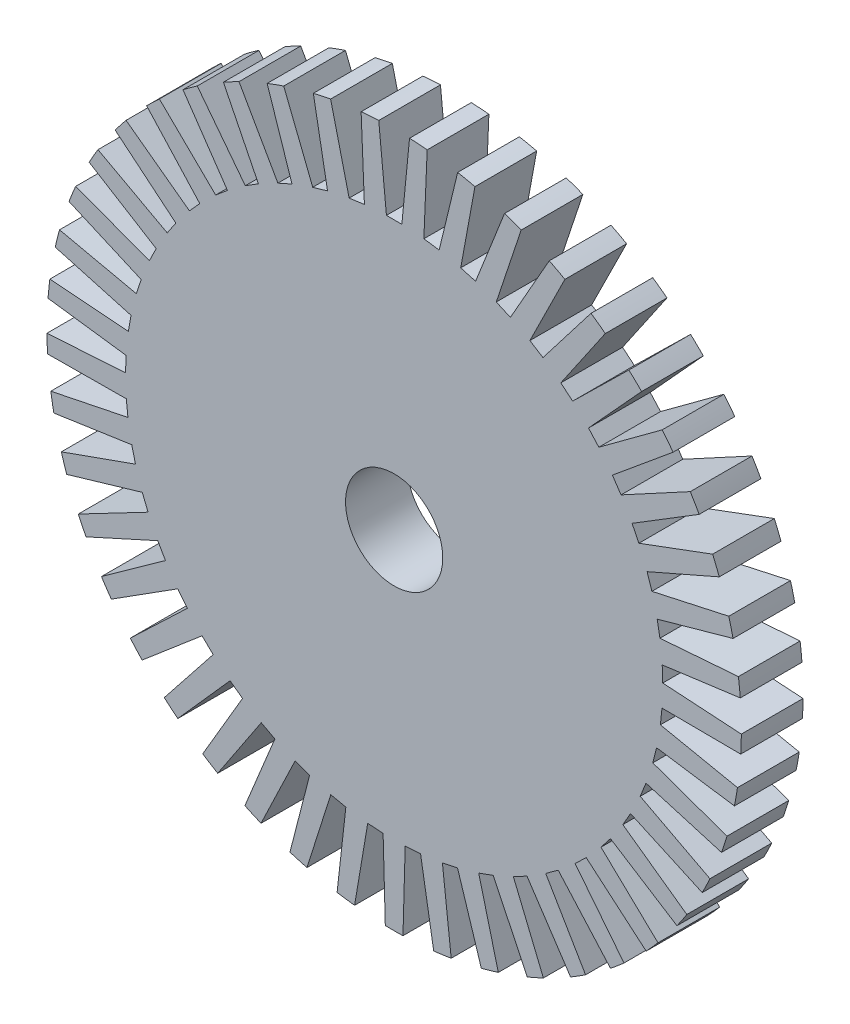
from build123d import *

# Parameters (mm, degrees)
SKETCH1_R           = 3.15
BOSS_EXTRUDE1_DEPTH = 4


with BuildPart() as part:
    # Sketch1 → Boss-Extrude1 (new body)
    with BuildSketch(Plane.XY):
        with BuildLine():
            Line((-0.5, 17.400093673), (-0.99782969, 22.477863242))
            ThreePointArc((-0.99782969, 22.477863242), (-1.569520659, 22.445191131), (-2.140195051, 22.397981274))
            Line((-2.140195051, 22.397981274), (-1.926490959, 17.300343708))
            Line((-1.926490959, 17.300343708), (-2.916759028, 17.161170607))
            Line((-2.916759028, 17.161170607), (-4.11643281, 22.12023917))
            ThreePointArc((-4.11643281, 22.12023917), (-4.678013043, 22.008321017), (-5.236563329, 21.882148078))
            Line((-5.236563329, 21.882148078), (-4.315484963, 16.863862232))
            Line((-4.315484963, 16.863862232), (-5.276746659, 16.588224876))
            Line((-5.276746659, 16.588224876), (-7.154914248, 21.332069804))
            ThreePointArc((-7.154914248, 21.332069804), (-7.695453225, 21.143083968), (-8.231007858, 20.94040376))
            Line((-8.231007858, 20.94040376), (-6.620482961, 16.099144859))
            Line((-6.620482961, 16.099144859), (-7.534028419, 15.692408216))
            Line((-7.534028419, 15.692408216), (-10.054133419, 20.128695964))
            ThreePointArc((-10.054133419, 20.128695964), (-10.563110163, 19.866320839), (-11.065245182, 19.591078303))
            Line((-11.065245182, 19.591078303), (-8.796620789, 15.021075944))
            Line((-8.796620789, 15.021075944), (-9.644668885, 14.49115668))
            Line((-9.644668885, 14.49115668), (-12.757660319, 18.533539953))
            ThreePointArc((-12.757660319, 18.533539953), (-13.225168177, 18.202882373), (-13.684110095, 17.860434791))
            Line((-13.684110095, 17.860434791), (-10.801542399, 13.650638873))
            Line((-10.801542399, 13.650638873), (-11.567586842, 13.007851263))
            Line((-11.567586842, 13.007851263), (-15.212873873, 16.577649668))
            ThreePointArc((-15.212873873, 16.577649668), (-15.629813335, 16.185145508), (-16.036629371, 15.782158231))
            Line((-16.036629371, 15.782158231), (-12.596224273, 12.014507643))
            Line((-12.596224273, 12.014507643), (-13.265354879, 11.271362817))
            Line((-13.265354879, 11.271362817), (-17.371986141, 14.29909429))
            ThreePointArc((-17.371986141, 14.29909429), (-17.730241956, 13.852383195), (-18.077013897, 13.396699914))
            Line((-18.077013897, 13.396699914), (-14.145734969, 10.144527688))
            Line((-14.145734969, 10.144527688), (-14.704927873, 9.315490115))
            Line((-14.704927873, 9.315490115), (-19.192972459, 11.742223306))
            ThreePointArc((-19.192972459, 11.742223306), (-19.485571585, 11.25), (-19.76554991, 10.750490071))
            Line((-19.76554991, 10.750490071), (-15.419915025, 8.077096041))
            Line((-15.419915025, 8.077096041), (-15.858286172, 7.178301995))
            Line((-15.858286172, 7.178301995), (-20.640389401, 8.956803302))
            ThreePointArc((-20.640389401, 8.956803302), (-20.861636728, 8.428648352), (-21.069371977, 7.895034167))
            Line((-21.069371977, 7.895034167), (-16.393963975, 5.852452907))
            Line((-16.393963975, 5.852452907), (-16.702980969, 4.901396391))
            Line((-16.702980969, 4.901396391), (-21.68606464, 5.99704931))
            ThreePointArc((-21.68606464, 5.99704931), (-21.831653841, 5.443242651), (-21.963102684, 4.885910404))
            Line((-21.963102684, 4.885910404), (-17.048923063, 3.513898434))
            Line((-17.048923063, 3.513898434), (-17.222571241, 2.529090681))
            Line((-17.222571241, 2.529090681), (-22.309645299, 2.920569575))
            ThreePointArc((-22.309645299, 2.920569575), (-22.376742646, 2.351890424), (-22.429346581, 1.781687953))
            Line((-22.429346581, 1.781687953), (-17.372044258, 1.106949925))
            Line((-17.372044258, 1.106949925), (-17.406943754, 0.107559098))
            Line((-17.406943754, 0.107559098), (-22.498994089, -0.212755725))
            ThreePointArc((-22.498994089, -0.212755725), (-22.486293608, -0.785238676), (-22.459028759, -1.357213028))
            Line((-22.459028759, -1.357213028), (-17.357038371, -1.321544105))
            Line((-17.357038371, -1.321544105), (-17.252509908, -2.316066))
            Line((-17.252509908, -2.316066), (-22.250425551, -3.341939976))
            ThreePointArc((-22.250425551, -3.341939976), (-22.158174443, -3.907083998), (-22.051571489, -4.469697401))
            Line((-22.051571489, -4.469697401), (-17.004197476, -3.724315782))
            Line((-17.004197476, -3.724315782), (-16.76227558, -4.694611508))
            Line((-16.76227558, -4.694611508), (-21.568777789, -6.406077168))
            ThreePointArc((-21.568777789, -6.406077168), (-21.398771617, -6.952882373), (-21.214905464, -7.495184198))
            Line((-21.214905464, -7.495184198), (-16.320389218, -6.054597889))
            Line((-16.320389218, -6.054597889), (-15.945782625, -6.981781743))
            Line((-15.945782625, -6.981781743), (-20.467318302, -9.345527354))
            ThreePointArc((-20.467318302, -9.345527354), (-20.222866042, -9.863350803), (-19.965315435, -10.374785761))
            Line((-19.965315435, -10.374785761), (-15.318923149, -8.267034135))
            Line((-15.318923149, -8.267034135), (-14.818923149, -9.133059538))
            Line((-14.818923149, -9.133059538), (-18.967485745, -12.103077481))
            ThreePointArc((-18.967485745, -12.103077481), (-18.653345382, -12.581840328), (-18.327123251, -13.05245392))
            Line((-18.327123251, -13.05245392), (-14.019291666, -10.318561965))
            Line((-14.019291666, -10.318561965), (-13.40363019, -11.106572718))
            Line((-13.40363019, -11.106572718), (-17.098472654, -14.625054971))
            ThreePointArc((-17.098472654, -14.625054971), (-16.720758573, -15.055438643), (-16.332214461, -15.47607091))
            Line((-16.332214461, -15.47607091), (-12.446790617, -12.169250723))
            Line((-12.446790617, -12.169250723), (-11.727450817, -12.863909094))
            Line((-11.727450817, -12.863909094), (-14.896657241, -16.862372403))
            ThreePointArc((-14.896657241, -16.862372403), (-14.462721218, -17.23599997), (-14.019417693, -17.598463784))
            Line((-14.019417693, -17.598463784), (-10.632026947, -13.783078859))
            Line((-10.632026947, -13.783078859), (-9.823009952, -14.370864111))
            Line((-9.823009952, -14.370864111), (-12.40489534, -18.771482936))
            ThreePointArc((-12.40489534, -18.771482936), (-11.923183445, -19.081082164), (-11.433748907, -19.378322578))
            Line((-11.433748907, -19.378322578), (-8.610322966, -15.128635043))
            Line((-8.610322966, -15.128635043), (-7.727375373, -15.598106606))
            Line((-7.727375373, -15.598106606), (-9.671686262, -20.315227906))
            ThreePointArc((-9.671686262, -20.315227906), (-9.151574469, -20.554772797), (-8.625535204, -20.781004366))
            Line((-8.625535204, -20.781004366), (-6.421028842, -16.179729554))
            Line((-6.421028842, -16.179729554), (-5.481336222, -16.521749697))
            Line((-5.481336222, -16.521749697), (-6.750228811, -21.463560073))
            ThreePointArc((-6.750228811, -21.463560073), (-6.201840506, -21.628388159), (-5.649435269, -21.779207542))
            Line((-5.649435269, -21.779207542), (-4.106756696, -16.915904033))
            Line((-4.106756696, -16.915904033), (-3.128609096, -17.123815724))
            Line((-3.128609096, -17.123815724), (-3.697385836, -22.194128457))
            ThreePointArc((-3.697385836, -22.194128457), (-3.131394772, -22.281031547), (-2.563375504, -22.353503216))
            Line((-2.563375504, -22.353503216), (-1.712551203, -17.322829682))
            Line((-1.712551203, -17.322829682), (-0.714987152, -17.392586156))
            Line((-0.714987152, -17.392586156), (-0.57257745, -22.492713377))
            ThreePointArc((-0.57257745, -22.492713377), (0, -22.5), (0.57257745, -22.492713377))
            Line((0.57257745, -22.492713377), (0.714987152, -17.392586156))
            Line((0.714987152, -17.392586156), (1.712551203, -17.322829682))
            Line((1.712551203, -17.322829682), (2.563375504, -22.353503216))
            ThreePointArc((2.563375504, -22.353503216), (3.131394772, -22.281031547), (3.697385836, -22.194128457))
            Line((3.697385836, -22.194128457), (3.128609096, -17.123815724))
            Line((3.128609096, -17.123815724), (4.106756696, -16.915904033))
            Line((4.106756696, -16.915904033), (5.64943527, -21.779207541))
            ThreePointArc((5.649435269, -21.779207542), (6.201840506, -21.628388159), (6.750228811, -21.463560073))
            Line((6.750228811, -21.463560073), (5.481336222, -16.521749697))
            Line((5.481336222, -16.521749697), (6.421028842, -16.179729554))
            Line((6.421028842, -16.179729554), (8.625535204, -20.781004366))
            ThreePointArc((8.625535204, -20.781004366), (9.151574469, -20.554772797), (9.671686262, -20.315227906))
            Line((9.671686262, -20.315227906), (7.727375373, -15.598106605))
            Line((7.727375373, -15.598106605), (8.610322966, -15.128635043))
            Line((8.610322966, -15.128635043), (11.433748907, -19.378322578))
            ThreePointArc((11.433748907, -19.378322578), (11.923183445, -19.081082164), (12.40489534, -18.771482936))
            Line((12.40489534, -18.771482936), (9.823009952, -14.370864111))
            Line((9.823009952, -14.370864111), (10.632026947, -13.783078859))
            Line((10.632026947, -13.783078859), (14.019417693, -17.598463784))
            ThreePointArc((14.019417693, -17.598463784), (14.462721218, -17.23599997), (14.896657241, -16.862372403))
            Line((14.896657241, -16.862372403), (11.727450817, -12.863909094))
            Line((11.727450817, -12.863909094), (12.446790617, -12.169250723))
            Line((12.446790617, -12.169250723), (16.332214461, -15.47607091))
            ThreePointArc((16.332214461, -15.47607091), (16.720758573, -15.055438643), (17.098472654, -14.625054971))
            Line((17.098472654, -14.625054971), (13.40363019, -11.106572718))
            Line((13.40363019, -11.106572718), (14.019291666, -10.318561965))
            Line((14.019291666, -10.318561965), (18.327123251, -13.05245392))
            ThreePointArc((18.327123251, -13.05245392), (18.653345383, -12.581840328), (18.967485745, -12.103077481))
            Line((18.967485745, -12.103077481), (14.818923149, -9.133059538))
            Line((14.818923149, -9.133059538), (15.318923149, -8.267034135))
            Line((15.318923149, -8.267034135), (19.965315435, -10.374785761))
            ThreePointArc((19.965315435, -10.374785761), (20.222866042, -9.863350803), (20.467318302, -9.345527354))
            Line((20.467318302, -9.345527354), (15.945782625, -6.981781743))
            Line((15.945782625, -6.981781743), (16.320389218, -6.054597889))
            Line((16.320389218, -6.054597889), (21.214905464, -7.495184198))
            ThreePointArc((21.214905464, -7.495184198), (21.398771617, -6.952882373), (21.568777789, -6.406077168))
            Line((21.568777789, -6.406077168), (16.76227558, -4.694611508))
            Line((16.76227558, -4.694611508), (17.004197476, -3.724315782))
            Line((17.004197476, -3.724315782), (22.051571489, -4.469697401))
            ThreePointArc((22.051571489, -4.469697401), (22.158174443, -3.907083997), (22.250425551, -3.341939976))
            Line((22.250425551, -3.341939976), (17.252509908, -2.316066))
            Line((17.252509908, -2.316066), (17.357038371, -1.321544105))
            Line((17.357038371, -1.321544105), (22.459028759, -1.357213028))
            ThreePointArc((22.459028759, -1.357213028), (22.486293608, -0.785238676), (22.498994089, -0.212755725))
            Line((22.498994089, -0.212755725), (17.406943754, 0.107559098))
            Line((17.406943754, 0.107559098), (17.372044258, 1.106949925))
            Line((17.372044258, 1.106949925), (22.429346581, 1.781687953))
            ThreePointArc((22.429346581, 1.781687953), (22.376742646, 2.351890424), (22.309645299, 2.920569575))
            Line((22.309645299, 2.920569575), (17.222571241, 2.529090681))
            Line((17.222571241, 2.529090681), (17.048923064, 3.513898434))
            Line((17.048923064, 3.513898434), (21.963102684, 4.885910404))
            ThreePointArc((21.963102684, 4.885910404), (21.831653841, 5.443242651), (21.68606464, 5.99704931))
            Line((21.68606464, 5.99704931), (16.702980969, 4.901396391))
            Line((16.702980969, 4.901396391), (16.393963975, 5.852452907))
            Line((16.393963975, 5.852452907), (21.069371977, 7.895034167))
            ThreePointArc((21.069371977, 7.895034167), (20.861636728, 8.428648352), (20.6403894, 8.956803302))
            Line((20.6403894, 8.956803302), (15.858286172, 7.178301995))
            Line((15.858286172, 7.178301995), (15.419915025, 8.077096041))
            Line((15.419915025, 8.077096041), (19.76554991, 10.750490071))
            ThreePointArc((19.76554991, 10.750490071), (19.485571585, 11.25), (19.192972459, 11.742223306))
            Line((19.192972459, 11.742223306), (14.704927873, 9.315490115))
            Line((14.704927873, 9.315490115), (14.145734969, 10.144527688))
            Line((14.145734969, 10.144527688), (18.077013897, 13.396699914))
            ThreePointArc((18.077013897, 13.396699914), (17.730241956, 13.852383195), (17.371986141, 14.29909429))
            Line((17.371986141, 14.29909429), (13.265354879, 11.271362817))
            Line((13.265354879, 11.271362817), (12.596224273, 12.014507643))
            Line((12.596224273, 12.014507643), (16.03662937, 15.782158231))
            ThreePointArc((16.03662937, 15.782158231), (15.629813335, 16.185145508), (15.212873873, 16.577649668))
            Line((15.212873873, 16.577649668), (11.567586842, 13.007851263))
            Line((11.567586842, 13.007851263), (10.801542399, 13.650638873))
            Line((10.801542399, 13.650638873), (13.684110095, 17.860434791))
            ThreePointArc((13.684110095, 17.860434791), (13.225168177, 18.202882373), (12.757660319, 18.533539953))
            Line((12.757660319, 18.533539953), (9.644668885, 14.49115668))
            Line((9.644668885, 14.49115668), (8.796620789, 15.021075944))
            Line((8.796620789, 15.021075944), (11.065245182, 19.591078303))
            ThreePointArc((11.065245182, 19.591078303), (10.563110163, 19.866320839), (10.054133419, 20.128695964))
            Line((10.054133419, 20.128695964), (7.534028419, 15.692408216))
            Line((7.534028419, 15.692408216), (6.620482961, 16.099144859))
            Line((6.620482961, 16.099144859), (8.231007858, 20.94040376))
            ThreePointArc((8.231007858, 20.94040376), (7.695453225, 21.143083968), (7.154914248, 21.332069804))
            Line((7.154914248, 21.332069804), (5.276746659, 16.588224876))
            Line((5.276746659, 16.588224876), (4.315484963, 16.863862232))
            Line((4.315484963, 16.863862232), (5.236563329, 21.882148078))
            ThreePointArc((5.236563329, 21.882148078), (4.678013043, 22.008321017), (4.11643281, 22.12023917))
            Line((4.11643281, 22.12023917), (2.916759028, 17.161170607))
            Line((2.916759028, 17.161170607), (1.926490959, 17.300343708))
            Line((1.926490959, 17.300343708), (2.140195051, 22.397981274))
            ThreePointArc((2.140195051, 22.397981274), (1.569520659, 22.445191131), (0.99782969, 22.477863242))
            Line((0.99782969, 22.477863242), (0.5, 17.400093673))
            Line((0.5, 17.400093673), (-0.5, 17.400093673))
        make_face()
        Circle(SKETCH1_R, mode=Mode.SUBTRACT)
    extrude(amount=BOSS_EXTRUDE1_DEPTH)


solid = part.part
